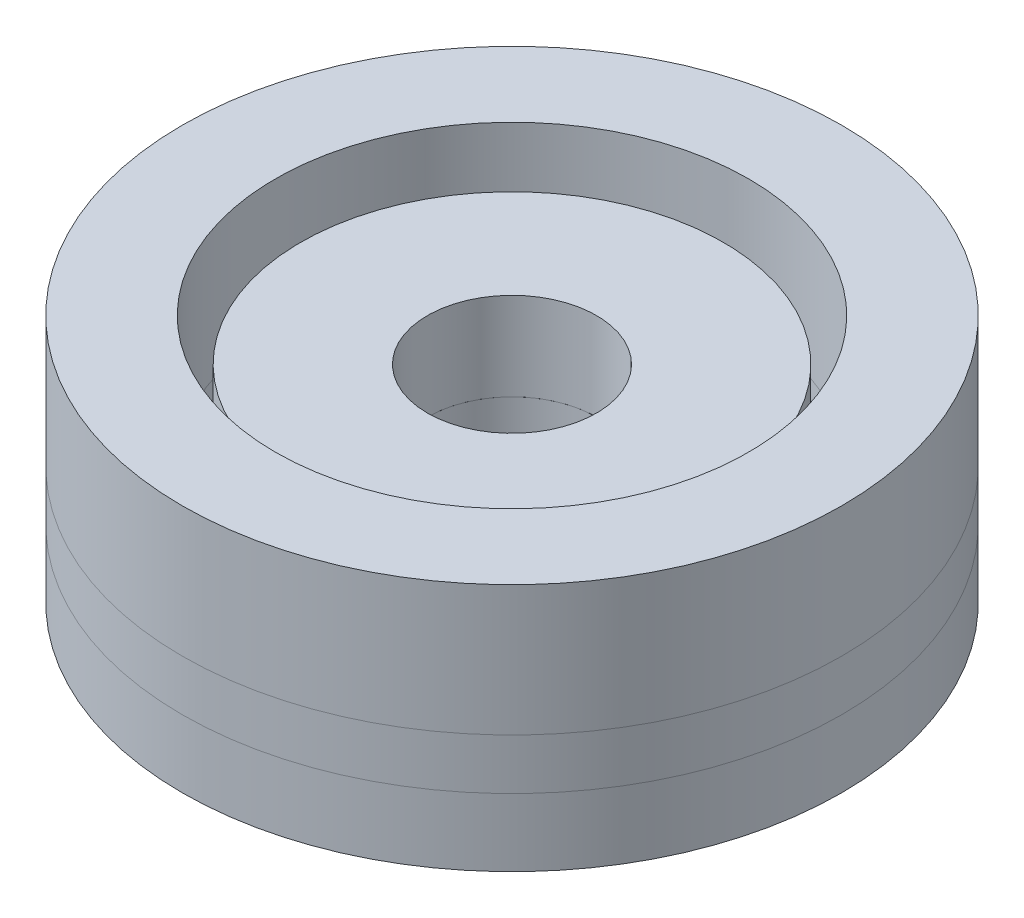
from build123d import *

# Parameters (mm, degrees)
SKETCH_8_R       = 195
SKETCH_8_R_2     = 140
EXTRUDE_1_DEPTH  = 77
SKETCH_10_R      = 195
SKETCH_10_R_2    = 140
EXTRUDE_2_DEPTH  = 30
SKETCH_11_R      = 195
SKETCH_11_R_2    = 165
EXTRUDE_3_DEPTH  = 40
SKETCH_12_R      = 125
SKETCH_12_R_2    = 50
EXTRUDE_4_DEPTH  = 52
SKETCH_17_R      = 125
SKETCH_17_R_2    = 50
EXTRUDE_9_DEPTH  = 30
SKETCH_18_R      = 125
SKETCH_18_R_2    = 50
EXTRUDE_10_DEPTH = 70


with BuildPart() as part:
    # 草图8 → 凸台-拉伸1 (new body)
    with BuildSketch(Plane(origin=(0, 0, 0), x_dir=(1, 0, 0), z_dir=(0, 1, 0))):
        with Locations(Location((514.982170762, 0, 0), (0, 0, 270))):
            Circle(SKETCH_8_R)
        with Locations(Location((514.982170762, 0, 0), (0, 0, 270))):
            Circle(SKETCH_8_R_2, mode=Mode.SUBTRACT)
    extrude(amount=-EXTRUDE_1_DEPTH)


with BuildPart() as body_2:
    # 草图10 → 凸台-拉伸2 (new body)
    with BuildSketch(Plane(origin=(0, -77, 0), x_dir=(-1, 0, 0), z_dir=(0, -1, 0))):
        with Locations(Location((-514.982170762, 0, 0), (0, 0, 90))):
            Circle(SKETCH_10_R)
        with Locations(Location((-514.982170762, 0, 0), (0, 0, 90))):
            Circle(SKETCH_10_R_2, mode=Mode.SUBTRACT)
    extrude(amount=EXTRUDE_2_DEPTH)


with BuildPart() as body_3:
    # 草图11 → 凸台-拉伸3 (new body)
    with BuildSketch(Plane(origin=(0, -107, 0), x_dir=(-1, 0, 0), z_dir=(0, -1, 0))):
        with Locations(Location((-514.982170762, 0, 0), (0, 0, 90))):
            Circle(SKETCH_11_R)
        with Locations(Location((-514.982170762, 0, 0), (0, 0, 90))):
            Circle(SKETCH_11_R_2, mode=Mode.SUBTRACT)
    extrude(amount=EXTRUDE_3_DEPTH)


with BuildPart() as body_4:
    # 草图12 → 凸台-拉伸4 (new body)
    with BuildSketch(Plane(origin=(0, -25, 0), x_dir=(1, 0, 0), z_dir=(0, 1, 0))):
        with Locations(Location((514.982170762, 0, 0), (0, 0, 270))):
            Circle(SKETCH_12_R)
        with Locations(Location((514.982170762, 0, 0), (0, 0, 270))):
            Circle(SKETCH_12_R_2, mode=Mode.SUBTRACT)
    extrude(amount=-EXTRUDE_4_DEPTH)


with BuildPart() as body_5:
    # 草图17 → 凸台-拉伸9 (new body)
    with BuildSketch(Plane(origin=(0, -77, 0), x_dir=(-1, 0, 0), z_dir=(0, -1, 0))):
        with Locations(Location((-514.982170762, 0, 0), (0, 0, 90))):
            Circle(SKETCH_17_R)
        with Locations(Location((-514.982170762, 0, 0), (0, 0, 90))):
            Circle(SKETCH_17_R_2, mode=Mode.SUBTRACT)
    extrude(amount=EXTRUDE_9_DEPTH)


with BuildPart() as body_6:
    # 草图18 → 凸台-拉伸10 (new body)
    with BuildSketch(Plane(origin=(0, -107, 0), x_dir=(-1, 0, 0), z_dir=(0, -1, 0))):
        with Locations(Location((-514.982170762, 0, 0), (0, 0, 90))):
            Circle(SKETCH_18_R)
        with Locations(Location((-514.982170762, 0, 0), (0, 0, 90))):
            Circle(SKETCH_18_R_2, mode=Mode.SUBTRACT)
    extrude(amount=EXTRUDE_10_DEPTH)


solid = Compound([part.part, body_2.part, body_3.part, body_4.part, body_5.part, body_6.part])
